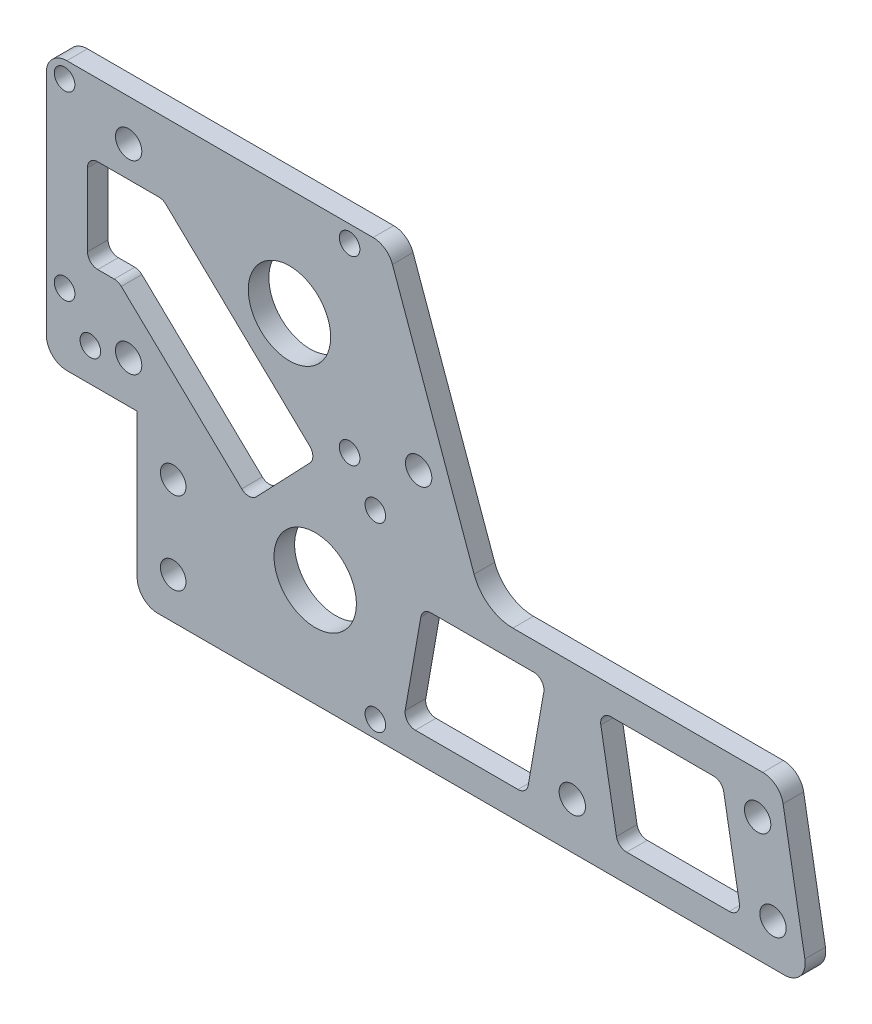
from build123d import *

# Parameters (mm, degrees)
BOSS_EXTRUDE1_DEPTH = 3.175
SKETCH2_R           = 6.35
SKETCH2_R_2         = 1.5875
SKETCH2_R_3         = 2.032
CUT_EXTRUDE1_DEPTH  = 123.537765163
SKETCH3_R           = 2.032
SKETCH3_R_2         = 1.9685
CUT_EXTRUDE2_DEPTH  = 123.537765163
FILLET1_R           = 3.175
SKETCH4_R           = 2.032
CUT_EXTRUDE3_DEPTH  = 123.027997459
CUT_EXTRUDE4_REACH  = 124.028
FILLET2_R           = 1.5875


with BuildPart() as part:
    # Sketch1 → Boss-Extrude1 (new body)
    with BuildSketch(Plane.XY):
        with BuildLine():
            Line((102.692805421, 0), (-0.911395616, 0))
            Line((-0.911395616, 0), (-0.911395616, 25.4))
            Line((-0.911395616, 25.4), (-14.924855892, 25.4))
            Line((-14.924855892, 25.4), (-14.924855892, 63.605318816))
            ThreePointArc((-14.924855892, 63.605318816), (-13.994919922, 65.850382846), (-11.749855892, 66.780318816))
            Line((-11.749855892, 66.780318816), (35.462394108, 66.780318816))
            ThreePointArc((35.462394108, 66.780318816), (37.289381836, 66.201997626), (38.450803758, 64.677714623))
            Line((38.450803758, 64.677714623), (51.036631355, 29.605208386))
            ThreePointArc((51.036631355, 29.605208386), (53.359475199, 26.556642379), (57.013450653, 25.4))
            Line((57.013450653, 25.4), (98.214100111, 25.4))
            Line((98.214100111, 25.4), (102.692805421, 0))
        make_face()
    extrude(amount=BOSS_EXTRUDE1_DEPTH)

    # Sketch2 → Cut-Extrude1 (cut, through all)
    with BuildSketch(Plane.XY.offset(3.175)):
        with Locations((22.571894108, 50.206818816)):
            Circle(SKETCH2_R)
        with Locations((26.540644108, 16.5735)):
            Circle(SKETCH2_R)
        with Locations((-8.130355892, 30.5435)):
            Circle(SKETCH2_R_2)
        with Locations((35.811644108, 30.5435)):
            Circle(SKETCH2_R_2)
        with Locations((35.811644108, 2.6035)):
            Circle(SKETCH2_R_2)
        with Locations((-8.130355892, 2.6035)):
            Circle(SKETCH2_R_2)
        with Locations((-12.099105892, 36.236818816)):
            Circle(SKETCH2_R_2)
        with Locations((31.842894108, 36.236818816)):
            Circle(SKETCH2_R_2)
        with Locations((31.842894108, 64.176818816)):
            Circle(SKETCH2_R_2)
        with Locations((-12.099105892, 64.176818816)):
            Circle(SKETCH2_R_2)
        with Locations((66.180305421, 7.14375)):
            Circle(SKETCH2_R_3)
    extrude(amount=-CUT_EXTRUDE1_DEPTH, mode=Mode.SUBTRACT)

    # Sketch3 → Cut-Extrude2 (cut, through all)
    with BuildSketch(Plane(origin=(0, 0, 0), x_dir=(-1, 0, 0), z_dir=(0, 0, -1))):
        with Locations((-42.489558108, 39.189568816)):
            Circle(SKETCH3_R)
        with Locations((-4.644854384, 19.05)):
            Circle(SKETCH3_R_2)
        with Locations((-4.644854384, 6.35)):
            Circle(SKETCH3_R_2)
    extrude(amount=-CUT_EXTRUDE2_DEPTH, mode=Mode.SUBTRACT)

    # Fillet1
    fillet1_edges = [part.edges().sort_by_distance(p)[0] for p in [
        (-14.924855892, 25.4, 1.5875),
        (98.214100111, 25.4, 1.5875),
        (102.692805421, 0, 1.5875),
        (-0.911395616, 0, 1.5875),
    ]]
    fillet(fillet1_edges, radius=FILLET1_R)

    # Sketch4 → Cut-Extrude3 (cut, through all)
    with BuildSketch(Plane.XY.offset(3.175)):
        with Locations((94.755305421, 19.05)):
            Circle(SKETCH4_R)
        with Locations((97.126377465, 6.35)):
            Circle(SKETCH4_R)
        with Locations((-2.224855892, 60.430318816)):
            Circle(SKETCH4_R)
        with Locations((-2.224855892, 31.855318816)):
            Circle(SKETCH4_R)
    extrude(amount=-CUT_EXTRUDE3_DEPTH, mode=Mode.SUBTRACT)

    # Sketch5 → Cut-Extrude4 (cut, up to next)
    with BuildSketch(Plane(origin=(0, 0, 0), x_dir=(-1, 0, 0), z_dir=(0, 0, -1)), mode=Mode.PRIVATE) as cut_extrude4_sk1:
        Polygon((-3.064970502, 55.667818816), (-26.831361929, 32.965995206), (-16.361313511, 22.004969641), (3.812355892, 41.275), (8.574855892, 41.275), (8.574855892, 55.667818816), align=None)
    cut_extrude4_tool1 = extrude(cut_extrude4_sk1.sketch, amount=-CUT_EXTRUDE4_REACH, mode=Mode.PRIVATE) & part.part
    # Sketch5 → Cut-Extrude4 (cut, up to next)
    with BuildSketch(Plane(origin=(0, 0, 0), x_dir=(-1, 0, 0), z_dir=(0, 0, -1)), mode=Mode.PRIVATE) as cut_extrude4_sk2:
        Polygon((-92.270683803, 4.2545), (-89.29642955, 21.122334072), (-70.24642955, 21.122334072), (-73.220683803, 4.2545), align=None)
    cut_extrude4_tool2 = extrude(cut_extrude4_sk2.sketch, amount=-CUT_EXTRUDE4_REACH, mode=Mode.PRIVATE) & part.part
    # Sketch5 → Cut-Extrude4 (cut, up to next)
    with BuildSketch(Plane(origin=(0, 0, 0), x_dir=(-1, 0, 0), z_dir=(0, 0, -1)), mode=Mode.PRIVATE) as cut_extrude4_sk3:
        Polygon((-40.089927038, 4.2545), (-59.139927038, 4.2545), (-62.114181291, 21.122334072), (-43.064181291, 21.122334072), align=None)
    cut_extrude4_tool3 = extrude(cut_extrude4_sk3.sketch, amount=-CUT_EXTRUDE4_REACH, mode=Mode.PRIVATE) & part.part
    add(cut_extrude4_tool1.solids().sort_by_distance((7.67675, 40.461869, 0))[0], mode=Mode.SUBTRACT)
    add(cut_extrude4_tool2.solids().sort_by_distance((81.258557, 12.688417, 0))[0], mode=Mode.SUBTRACT)
    add(cut_extrude4_tool3.solids().sort_by_distance((51.102054, 12.688417, 0))[0], mode=Mode.SUBTRACT)

    # Fillet2
    fillet2_edges = [part.edges().sort_by_distance(p)[0] for p in [
        (3.064970502, 55.667818816, 1.5875),
        (-8.574855892, 55.667818816, 1.5875),
        (-8.574855892, 41.275, 1.5875),
        (-3.812355892, 41.275, 1.5875),
        (16.361313511, 22.004969641, 1.5875),
        (26.831361929, 32.965995206, 1.5875),
        (73.220683803, 4.2545, 1.5875),
        (92.270683803, 4.2545, 1.5875),
        (89.29642955, 21.122334072, 1.5875),
        (70.24642955, 21.122334072, 1.5875),
        (43.064181291, 21.122334072, 1.5875),
        (40.089927038, 4.2545, 1.5875),
        (59.139927038, 4.2545, 1.5875),
        (62.114181291, 21.122334072, 1.5875),
    ]]
    fillet(fillet2_edges, radius=FILLET2_R)


solid = part.part
